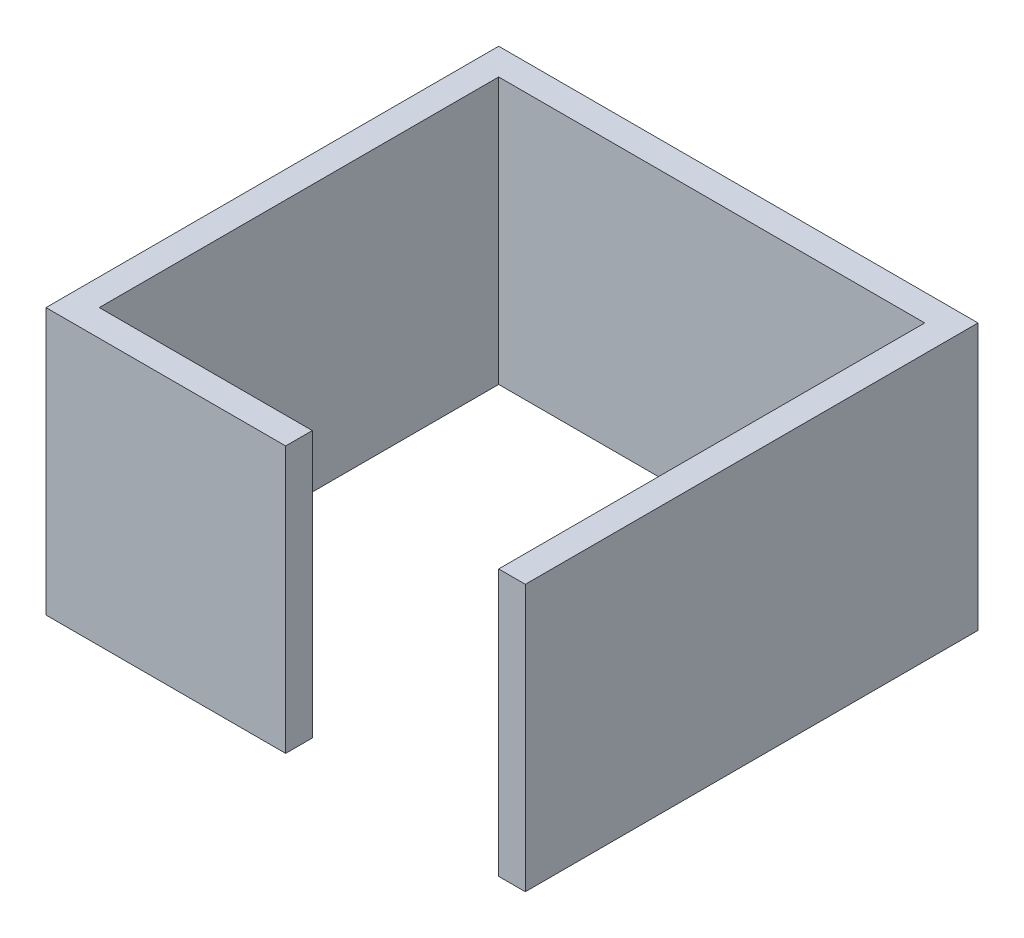
from build123d import *

# Parameters (mm, degrees)
BOSS_EXTRUDE1_DEPTH = 100
SKETCH2_W           = 10
SKETCH2_H           = 100
BOSS_EXTRUDE2_DEPTH = 80


with BuildPart() as part:
    # Sketch1 → Boss-Extrude1 (new body)
    with BuildSketch(Plane(origin=(0, 0, 0), x_dir=(1, 0, 0), z_dir=(0, 1, 0))):
        Polygon((0, 0), (0, 170), (-180, 170), (-180, 0), (-170, 0), (-170, 160), (-10, 160), (-10, 0), align=None)
    extrude(amount=BOSS_EXTRUDE1_DEPTH)

    # Sketch2 → Boss-Extrude2 (add)
    with BuildSketch(Plane(origin=(-170, 0, 0), x_dir=(0, 0, -1), z_dir=(1, 0, 0))):
        with Locations((5, 50)):
            Rectangle(SKETCH2_W, SKETCH2_H)
    extrude(amount=BOSS_EXTRUDE2_DEPTH)


solid = part.part
